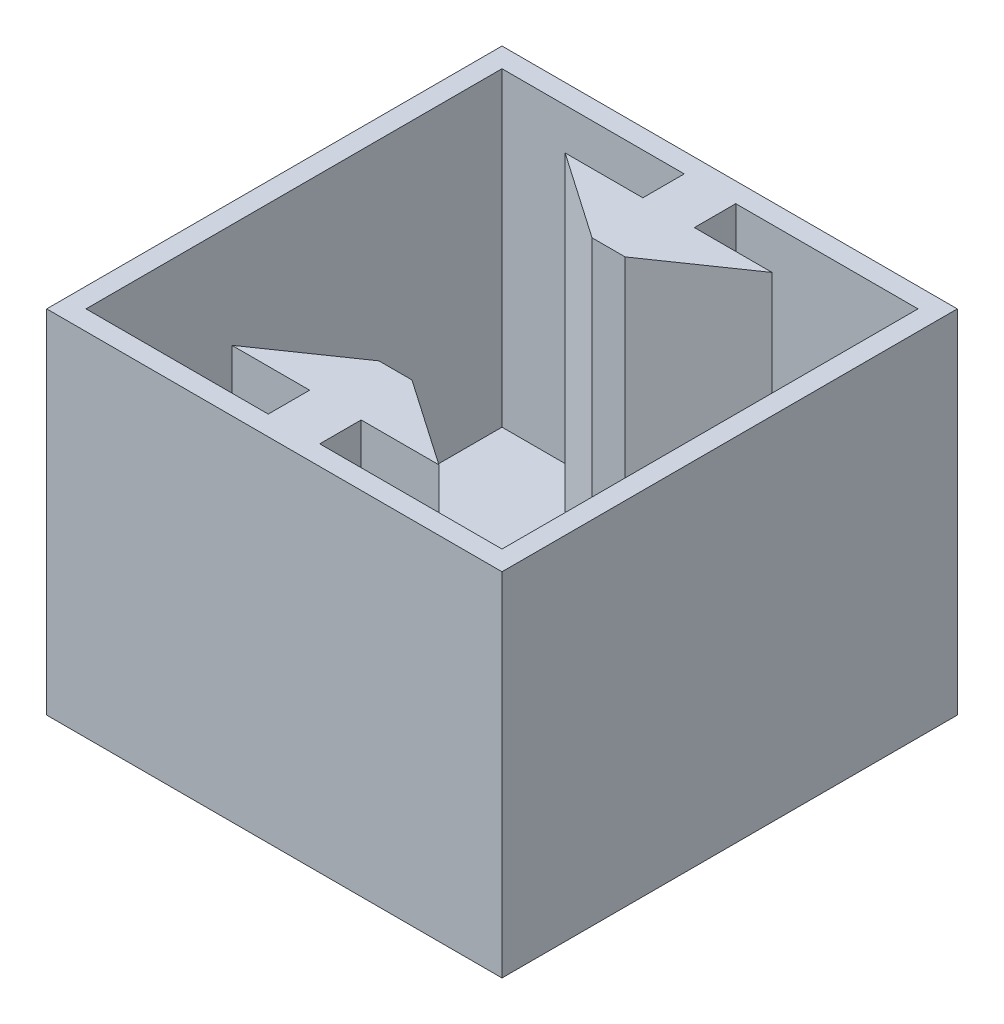
from build123d import *

# Parameters (mm, degrees)
SKETCH1_W           = 22
SKETCH1_H           = 22
SKETCH1_W_2         = 20.1
SKETCH1_H_2         = 20.1
BOSS_EXTRUDE1_DEPTH = 15
SKETCH2_W           = 22
SKETCH2_H           = 22
BOSS_EXTRUDE2_DEPTH = 2


with BuildPart() as part:
    # Sketch1 → Boss-Extrude1 (new body)
    # profile 1 of 3: a face of its own
    with BuildSketch(Plane(origin=(0, 0, 0), x_dir=(1, 0, 0), z_dir=(0, 1, 0))):
        Rectangle(SKETCH1_W, SKETCH1_H)
        Rectangle(SKETCH1_W_2, SKETCH1_H_2, mode=Mode.SUBTRACT)
    # profile 2 of 3: a face of its own
    with BuildSketch(Plane(origin=(0, 0, 0), x_dir=(1, 0, 0), z_dir=(0, 1, 0))):
        Polygon((1.245, 10.05), (-1.245, 10.05), (-1.245, 8.05), (-5, 8.05), (-0.799132047, 5.15), (0.799132047, 5.15), (5, 8.05), (1.245, 8.05), align=None)
    # profile 3 of 3: a face of its own
    with BuildSketch(Plane(origin=(0, 0, 0), x_dir=(1, 0, 0), z_dir=(0, 1, 0))):
        Polygon((-1.245, -8.05), (-1.245, -10.05), (1.245, -10.05), (1.245, -8.05), (5, -8.05), (0.799132047, -5.15), (-0.799132047, -5.15), (-5, -8.05), align=None)
    extrude(amount=BOSS_EXTRUDE1_DEPTH)

    # Sketch2 → Boss-Extrude2 (add)
    with BuildSketch(Plane.XZ):
        Rectangle(SKETCH2_W, SKETCH2_H)
    extrude(amount=BOSS_EXTRUDE2_DEPTH)


solid = part.part
